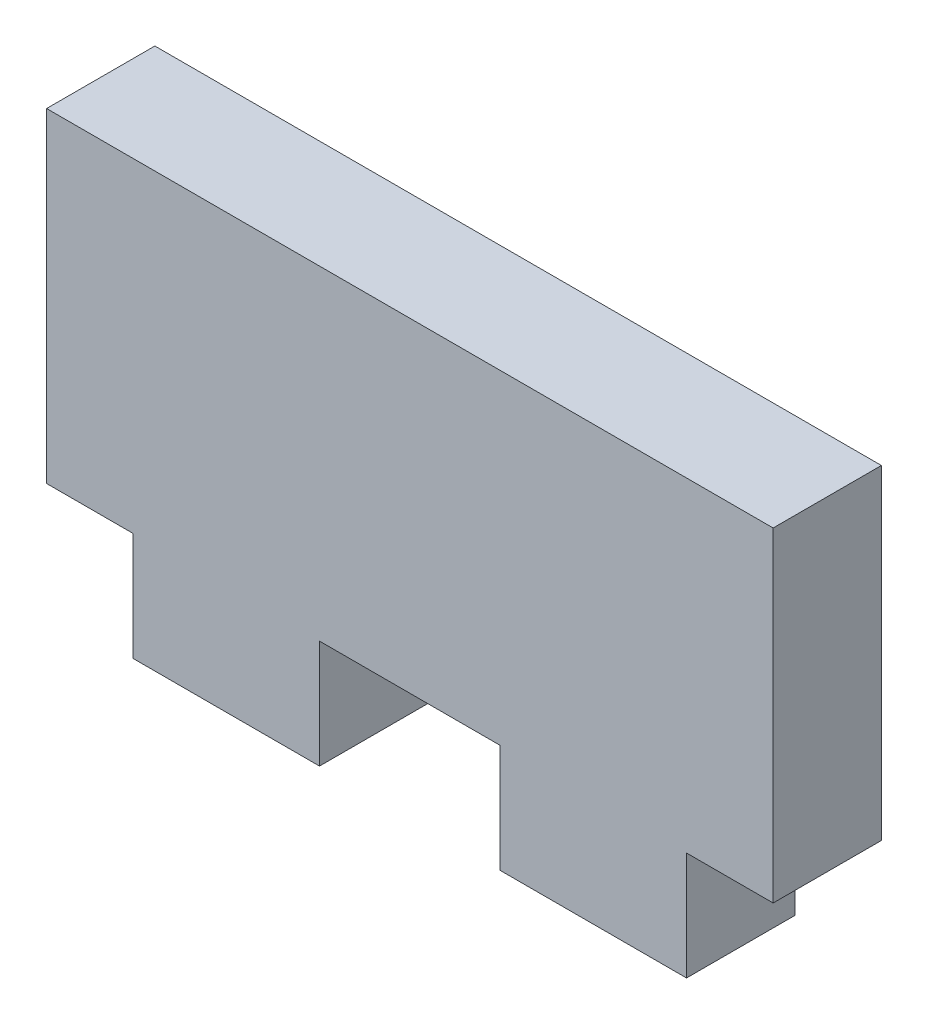
from build123d import *

# Parameters (mm, degrees)
BOSS_EXTRUDE1_DEPTH = 5


with BuildPart() as part:
    # Sketch1 → Boss-Extrude1 (new body)
    with BuildSketch(Plane.XY):
        Polygon((-44.39147487, 39.614086071), (-10.83627487, 39.614086071), (-10.83627487, 24.614086071), (-14.83627487, 24.614086071), (-14.83627487, 19.614086071), (-23.44047487, 19.614086071), (-23.44047487, 24.614086071), (-31.78717487, 24.614086071), (-31.78717487, 19.614086071), (-40.39147487, 19.614086071), (-40.39147487, 24.614086071), (-44.39147487, 24.614086071), align=None)
    extrude(amount=BOSS_EXTRUDE1_DEPTH)


solid = part.part
